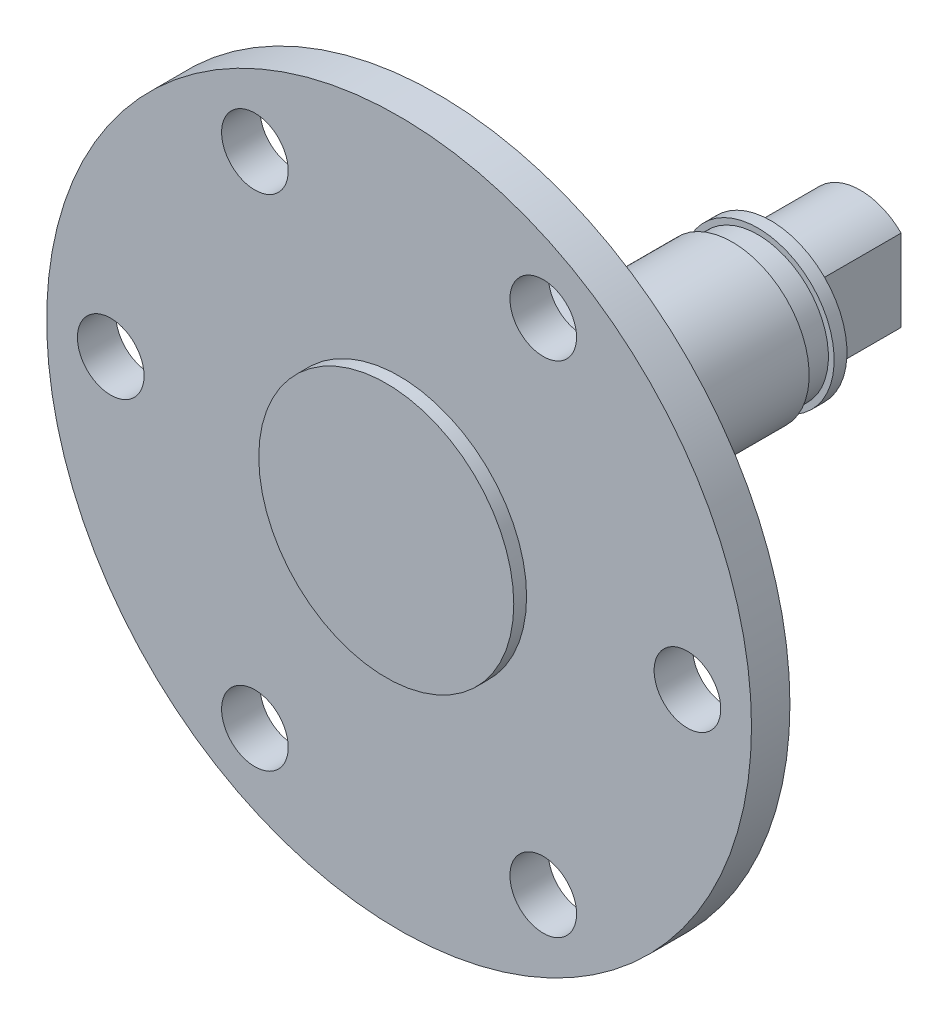
from build123d import *

# Parameters (mm, degrees)
SKETCH_1_R          = 27.5
EXTRUDE_1_DEPTH     = 3
SKETCH_2_R          = 2.6
CUT_EXTRUDE_1_DEPTH = 5
SKETCH_3_R          = 9.95
EXTRUDE_2_DEPTH     = 1
SKETCH_4_R          = 8
EXTRUDE_3_DEPTH     = 13
SKETCH_5_R          = 6
EXTRUDE_4_DEPTH     = 10
SKETCH_6_R          = 5.5
EXTRUDE_5_DEPTH     = 2
SKETCH_7_R          = 5.95
EXTRUDE_6_DEPTH     = 1
FILLET_1_R          = 5
SKETCH_8_W          = 6.35
SKETCH_8_H          = 6.377891502
EXTRUDE_7_DEPTH     = 7


with BuildPart() as part:
    # 草图1 → 凸台-拉伸1 (new body)
    with BuildSketch(Plane.XY):
        Circle(SKETCH_1_R)
    extrude(amount=EXTRUDE_1_DEPTH)

    # 草图2 → 切除-拉伸1 (cut)
    with BuildSketch(Plane.XY.offset(3)):
        with Locations((22.5, 0)):
            Circle(SKETCH_2_R)
        with Locations((11.25, -19.485571585)):
            Circle(SKETCH_2_R)
        with Locations((-11.25, -19.485571585)):
            Circle(SKETCH_2_R)
        with Locations((-22.5, 0)):
            Circle(SKETCH_2_R)
        with Locations((-11.25, 19.485571585)):
            Circle(SKETCH_2_R)
        with Locations((11.25, 19.485571585)):
            Circle(SKETCH_2_R)
    extrude(amount=-CUT_EXTRUDE_1_DEPTH, mode=Mode.SUBTRACT)

    # 草图3 → 凸台-拉伸2 (add)
    with BuildSketch(Plane.XY.offset(3)):
        Circle(SKETCH_3_R)
    extrude(amount=EXTRUDE_2_DEPTH)

    # 草图4 → 凸台-拉伸3 (add)
    with BuildSketch(Plane(origin=(0, 0, 0), x_dir=(-1, 0, 0), z_dir=(0, 0, -1))):
        with Locations(Location((0, 0, 0), (0, 0, 180))):
            Circle(SKETCH_4_R)
    extrude(amount=EXTRUDE_3_DEPTH)

    # 草图5 → 凸台-拉伸4 (add)
    with BuildSketch(Plane(origin=(0, 0, -13), x_dir=(-1, 0, 0), z_dir=(0, 0, -1))):
        Circle(SKETCH_5_R)
    extrude(amount=EXTRUDE_4_DEPTH)

    # 草图6 → 凸台-拉伸5 (add)
    with BuildSketch(Plane(origin=(0, 0, -23), x_dir=(-1, 0, 0), z_dir=(0, 0, -1))):
        Circle(SKETCH_6_R)
    extrude(amount=EXTRUDE_5_DEPTH)

    # 草图7 → 凸台-拉伸6 (add)
    with BuildSketch(Plane(origin=(0, 0, -25), x_dir=(-1, 0, 0), z_dir=(0, 0, -1))):
        Circle(SKETCH_7_R)
    extrude(amount=EXTRUDE_6_DEPTH)

    # 圆角1
    fillet_1_edges = [part.edges().sort_by_distance(p)[0] for p in [
        (-8, 0, 0),
    ]]
    fillet(fillet_1_edges, radius=FILLET_1_R)

    # 草图8 → 凸台-拉伸7 (add)
    with BuildSketch(Plane(origin=(0, 0, -26), x_dir=(-1, 0, 0), z_dir=(0, 0, -1))):
        Rectangle(SKETCH_8_W, SKETCH_8_H)
        with BuildLine():
            Line((3.175, -3.188945751), (-3.175, -3.188945751))
            ThreePointArc((-3.175, -3.188945751), (0, -4.5), (3.175, -3.188945751))
        make_face()
        with BuildLine():
            ThreePointArc((3.175, 3.188945751), (0, 4.5), (-3.175, 3.188945751))
            Line((-3.175, 3.188945751), (3.175, 3.188945751))
        make_face()
    extrude(amount=EXTRUDE_7_DEPTH)


solid = part.part
